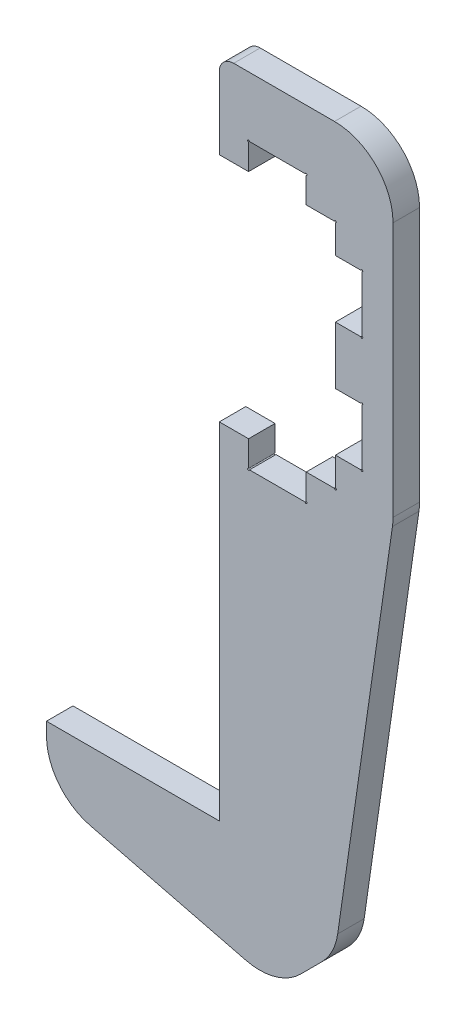
from build123d import *

# Parameters (mm, degrees)
BOSS_EXTRUDE1_DEPTH = 5.842
FILLET1_R           = 12.7
FILLET2_R           = 3.175
SKETCH2_R           = 0.1984375
CUT_EXTRUDE1_DEPTH  = 136.775443647


with BuildPart() as part:
    # Sketch1 → Boss-Extrude1 (new body)
    with BuildSketch(Plane.XY):
        with BuildLine():
            Line((-12.8, -25.5), (-6.35, -25.5))
            Line((-6.35, -25.5), (-6.35, -31.342))
            Line((-6.35, -31.342), (6.35, -31.342))
            Line((6.35, -31.342), (6.35, -25.5))
            Line((6.35, -25.5), (12.8, -25.5))
            Line((12.8, -25.5), (12.8, -19.05))
            Line((12.8, -19.05), (18.642, -19.05))
            Line((18.642, -19.05), (18.642, -6.35))
            Line((18.642, -6.35), (12.8, -6.35))
            Line((12.8, -6.35), (12.8, 6.35))
            Line((12.8, 6.35), (18.642, 6.35))
            Line((18.642, 6.35), (18.642, 19.05))
            Line((18.642, 19.05), (12.8, 19.05))
            Line((12.8, 19.05), (12.8, 25.5))
            Line((12.8, 25.5), (6.35, 25.5))
            Line((6.35, 25.5), (6.35, 31.342))
            Line((6.35, 31.342), (-6.35, 31.342))
            Line((-6.35, 31.342), (-6.35, 25.5))
            Line((-6.35, 25.5), (-12.8, 25.5))
            Line((-12.8, 25.5), (-12.8, 44.55))
            Line((-12.8, 44.55), (12.6, 44.55))
            ThreePointArc((12.6, 44.55), (21.721677477, 40.771677477), (25.5, 31.65))
            Line((25.5, 31.65), (25.5, 25.3))
            Line((25.5, 25.3), (25.5, -25.5))
            Line((25.5, -25.5), (12.7, -114.4))
            Line((12.7, -114.4), (0, -127.1))
            Line((0, -127.1), (-50.9, -114.4))
            Line((-50.9, -114.4), (-50.9, -101.7))
            Line((-50.9, -101.7), (-12.8, -101.7))
            Line((-12.8, -101.7), (-12.8, -25.5))
        make_face()
    extrude(amount=BOSS_EXTRUDE1_DEPTH)

    # Fillet1
    fillet1_edges = [part.edges().sort_by_distance(p)[0] for p in [
        (25.5, -25.5, 2.921),
        (12.7, -114.4, 2.921),
        (0, -127.1, 2.921),
        (-50.9, -114.4, 2.921),
    ]]
    fillet(fillet1_edges, radius=FILLET1_R)

    # Fillet2
    fillet2_edges = [part.edges().sort_by_distance(p)[0] for p in [
        (-12.8, 44.55, 2.921),
    ]]
    fillet(fillet2_edges, radius=FILLET2_R)

    # Sketch2 → Cut-Extrude1 (cut, through all)
    with BuildSketch(Plane.XY.offset(5.842)):
        with Locations((-6.35, 31.342)):
            Circle(SKETCH2_R)
        with Locations((6.35, 31.342)):
            Circle(SKETCH2_R)
        with Locations((18.642, 19.05)):
            Circle(SKETCH2_R)
        with Locations((12.8, 25.5)):
            Circle(SKETCH2_R)
        with Locations((18.642, 6.35)):
            Circle(SKETCH2_R)
        with Locations((18.642, -6.35)):
            Circle(SKETCH2_R)
        with Locations((12.8, -25.5)):
            Circle(SKETCH2_R)
        with Locations((18.642, -19.05)):
            Circle(SKETCH2_R)
        with Locations((6.35, -31.342)):
            Circle(SKETCH2_R)
        with Locations((-6.35, -31.342)):
            Circle(SKETCH2_R)
    extrude(amount=-CUT_EXTRUDE1_DEPTH, mode=Mode.SUBTRACT)


solid = part.part
